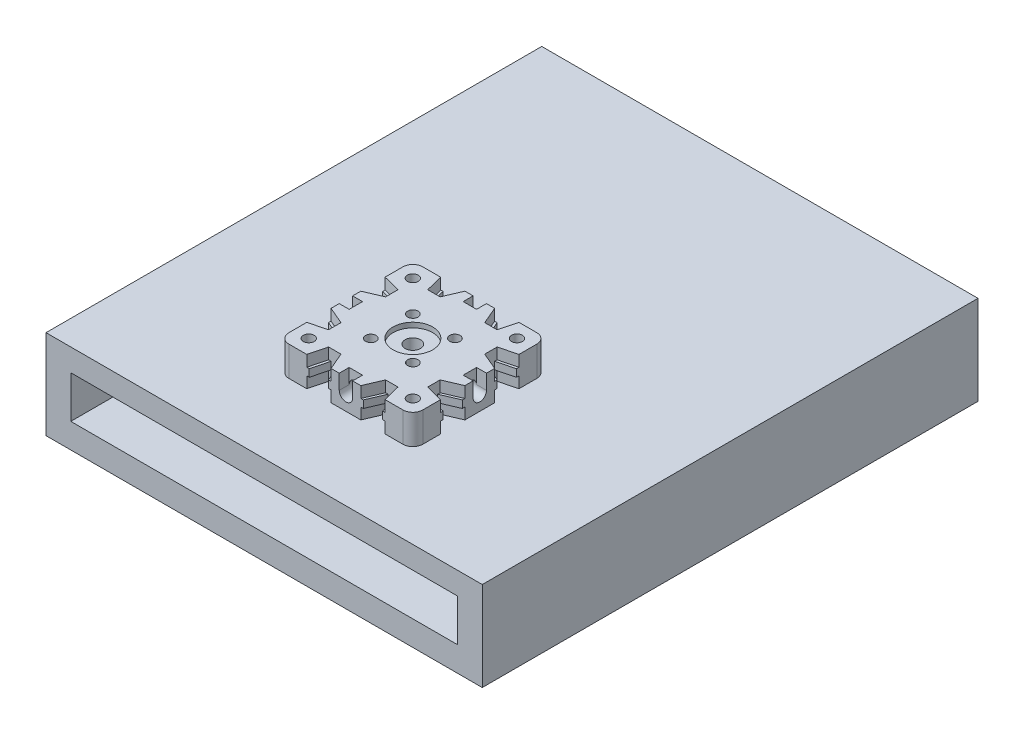
from build123d import *

# Parameters (mm, degrees)
SKETCH_3_W                      = 27
SKETCH_3_H                      = 27
EXTRUDE_1_DEPTH                 = 3
FILLET_1_R                      = 2
SKETCH_4_R                      = 1.1
CUT_EXTRUDE_1_DEPTH             = 6
SKETCH_5_R                      = 1.55
CUT_EXTRUDE_2_DEPTH             = 6
SKETCH_6_R                      = 1.05
CUT_EXTRUDE_3_DEPTH             = 6
PATTERN_CIRCULAR_1_COUNT        = 4
SKETCH_7_R                      = 4
CUT_EXTRUDE_4_DEPTH             = 1
CUT_EXTRUDE_8_DEPTH             = 21.012496096
PATTERN_CIRCULAR_2_COUNT        = 4
PATTERN_CIRCULAR_2_COPY_1_DEPTH = 21.012496096
PATTERN_CIRCULAR_2_COPY_2_DEPTH = 21.012496096
PATTERN_CIRCULAR_2_COPY_3_DEPTH = 21.012496096
SKETCH_12_R                     = 1.35
CUT_EXTRUDE_9_DEPTH             = 8
PATTERN_CIRCULAR_3_COUNT        = 4
EXTRUDE_2_DEPTH                 = 0.75
PATTERN_CIRCULAR_4_COUNT        = 4
PATTERN_CIRCULAR_4_COPY_1_DEPTH = 0.75
PATTERN_CIRCULAR_4_COPY_2_DEPTH = 0.75
PATTERN_CIRCULAR_4_COPY_3_DEPTH = 0.75
SKETCH_22_W                     = 2.7
SKETCH_22_H                     = 3
CUT_EXTRUDE_15_DEPTH            = 2
PATTERN_CIRCULAR_11_COUNT       = 4
SKETCH_31_W                     = 88
SKETCH_31_H                     = 100
EXTRUDE_4_DEPTH                 = 18
SKETCH_32_W                     = 78
SKETCH_32_H                     = 8.5
CUT_EXTRUDE_17_DEPTH            = 95


with BuildPart() as part:
    # ｽｹｯﾁ3 → ﾎﾞｽ - 押し出し1 (new, symmetric)
    with BuildSketch(Plane(origin=(0, 0, 0), x_dir=(1, 0, 0), z_dir=(0, 1, 0))):
        Rectangle(SKETCH_3_W, SKETCH_3_H)
    extrude(amount=EXTRUDE_1_DEPTH, both=True)

    # ﾌｨﾚｯﾄ1
    fillet_1_edges = [part.edges().sort_by_distance(p)[0] for p in [
        (13.5, 0, 13.5),
        (-13.5, 0, 13.5),
        (-13.5, 0, -13.5),
        (13.5, 0, -13.5),
    ]]
    fillet(fillet_1_edges, radius=FILLET_1_R)

    # ｽｹｯﾁ4 → ｶｯﾄ - 押し出し1 (cut)
    with BuildSketch(Plane(origin=(0, 3, 0), x_dir=(1, 0, 0), z_dir=(0, 1, 0))):
        with Locations(Location((-10.5, 10.5, 0), (0, 0, 270))):
            Circle(SKETCH_4_R)
        with Locations(Location((10.5, 10.5, 0), (0, 0, 270))):
            Circle(SKETCH_4_R)
        with Locations(Location((-10.5, -10.5, 0), (0, 0, 270))):
            Circle(SKETCH_4_R)
        with Locations(Location((10.5, -10.5, 0), (0, 0, 270))):
            Circle(SKETCH_4_R)
    extrude(amount=-CUT_EXTRUDE_1_DEPTH, mode=Mode.SUBTRACT)

    # ｽｹｯﾁ5 → ｶｯﾄ - 押し出し2 (cut)
    with BuildSketch(Plane(origin=(0, 3, 0), x_dir=(1, 0, 0), z_dir=(0, 1, 0))):
        with Locations(Location((0, 0, 0), (0, 0, 270))):
            Circle(SKETCH_5_R)
    extrude(amount=-CUT_EXTRUDE_2_DEPTH, mode=Mode.SUBTRACT)

    # ｽｹｯﾁ6 → ｶｯﾄ - 押し出し3 (cut)
    with BuildSketch(Plane(origin=(0, 3, 0), x_dir=(1, 0, 0), z_dir=(0, 1, 0))):
        with Locations(Location((4.242640687, 4.242640687, 0), (0, 0, 270))):
            Circle(SKETCH_6_R)
    cut_extrude_3 = extrude(amount=-CUT_EXTRUDE_3_DEPTH, mode=Mode.SUBTRACT)

    # 円形ﾊﾟﾀｰﾝ1: ｶｯﾄ - 押し出し3 ×4 about axis
    pattern_circular_1_axis = Axis((0, 0, 0), (0, 1, 0))
    for i in range(1, PATTERN_CIRCULAR_1_COUNT):
        add(cut_extrude_3.rotate(pattern_circular_1_axis, i * 360 / PATTERN_CIRCULAR_1_COUNT), mode=Mode.SUBTRACT)

    # ｽｹｯﾁ7 → ｶｯﾄ - 押し出し4 (cut)
    with BuildSketch(Plane(origin=(0, 3, 0), x_dir=(1, 0, 0), z_dir=(0, 1, 0))):
        with Locations(Location((0, 0, 0), (0, 0, 270))):
            Circle(SKETCH_7_R)
    extrude(amount=-CUT_EXTRUDE_4_DEPTH, mode=Mode.SUBTRACT)

    # ｽｹｯﾁ11 → ｶｯﾄ - 押し出し8 (cut, symmetric)
    with BuildSketch(Plane(origin=(0, 3, 0), x_dir=(1, 0, 0), z_dir=(0, 1, 0))):
        Polygon((-28.082033535, 86.024744916), (3, 13.5), (4.5, 10), (7, 10), (7.9, 13.5), (27.55047658, 89.918520033), (16.532211377, 247.342544779), (-39.100298738, 243.448769662), align=None)
    cut_extrude_8 = extrude(amount=CUT_EXTRUDE_8_DEPTH, both=True, mode=Mode.SUBTRACT)

    # ﾐﾗｰ1: ｶｯﾄ - 押し出し8 across plane
    add(cut_extrude_8.mirror(Plane(origin=(0, 0, 0), x_dir=(0, 0, 1), z_dir=(1, 0, 0))), mode=Mode.SUBTRACT)

    # 円形ﾊﾟﾀｰﾝ2: ｶｯﾄ - 押し出し8 ×4 about axis
    pattern_circular_2_axis = Axis((0, 0, 0), (0, 1, 0))
    for i in range(1, PATTERN_CIRCULAR_2_COUNT):
        add(cut_extrude_8.rotate(pattern_circular_2_axis, i * 360 / PATTERN_CIRCULAR_2_COUNT), mode=Mode.SUBTRACT)

    # 円形ﾊﾟﾀｰﾝ2 copy 1 sketch → 円形ﾊﾟﾀｰﾝ2 copy 1 (cut, symmetric)
    with BuildSketch(Plane.ZX.offset(3)):
        Polygon((-28.082033535, -86.024744916), (3, -13.5), (4.5, -10), (7, -10), (7.9, -13.5), (27.55047658, -89.918520033), (16.532211377, -247.342544779), (-39.100298738, -243.448769662), align=None)
    extrude(amount=PATTERN_CIRCULAR_2_COPY_1_DEPTH, both=True, mode=Mode.SUBTRACT)

    # 円形ﾊﾟﾀｰﾝ2 copy 2 sketch → 円形ﾊﾟﾀｰﾝ2 copy 2 (cut, symmetric)
    with BuildSketch(Plane(origin=(0, 3, 0), x_dir=(1, 0, 0), z_dir=(0, 1, 0))):
        Polygon((-28.082033535, -86.024744916), (3, -13.5), (4.5, -10), (7, -10), (7.9, -13.5), (27.55047658, -89.918520033), (16.532211377, -247.342544779), (-39.100298738, -243.448769662), align=None)
    extrude(amount=PATTERN_CIRCULAR_2_COPY_2_DEPTH, both=True, mode=Mode.SUBTRACT)

    # 円形ﾊﾟﾀｰﾝ2 copy 3 sketch → 円形ﾊﾟﾀｰﾝ2 copy 3 (cut, symmetric)
    with BuildSketch(Plane(origin=(0, 3, 0), x_dir=(0, 0, -1), z_dir=(0, 1, 0))):
        Polygon((-28.082033535, -86.024744916), (3, -13.5), (4.5, -10), (7, -10), (7.9, -13.5), (27.55047658, -89.918520033), (16.532211377, -247.342544779), (-39.100298738, -243.448769662), align=None)
    extrude(amount=PATTERN_CIRCULAR_2_COPY_3_DEPTH, both=True, mode=Mode.SUBTRACT)

    # ｽｹｯﾁ12 → ｶｯﾄ - 押し出し9 (cut)
    with BuildSketch(Plane.XY.offset(13.5)):
        Circle(SKETCH_12_R)
    cut_extrude_9 = extrude(amount=-CUT_EXTRUDE_9_DEPTH, mode=Mode.SUBTRACT)

    # 円形ﾊﾟﾀｰﾝ3: ｶｯﾄ - 押し出し9 ×4 about axis
    pattern_circular_3_axis = Axis((0, 0, 0), (0, 1, 0))
    for i in range(1, PATTERN_CIRCULAR_3_COUNT):
        add(cut_extrude_9.rotate(pattern_circular_3_axis, i * 360 / PATTERN_CIRCULAR_3_COUNT), mode=Mode.SUBTRACT)

    # ｽｹｯﾁ13 → ﾎﾞｽ - 押し出し2 (add, symmetric)
    with BuildSketch(Plane(origin=(0, 0, 0), x_dir=(1, 0, 0), z_dir=(0, 1, 0))):
        Polygon((7.9, 13.5), (7, 10), (6.5, 10), (7.4, 13.5), align=None)
        Polygon((3, 13.5), (3.5, 13.5), (5, 10), (4.5, 10), align=None)
    extrude_2 = extrude(amount=EXTRUDE_2_DEPTH, both=True)

    # ﾐﾗｰ2: ﾎﾞｽ - 押し出し2 across plane
    add(extrude_2.mirror(Plane(origin=(0, 0, 0), x_dir=(0, 0, 1), z_dir=(1, 0, 0))))

    # 円形ﾊﾟﾀｰﾝ4: ﾎﾞｽ - 押し出し2 ×4 about axis
    pattern_circular_4_axis = Axis((0, 0, 0), (0, 1, 0))
    for i in range(1, PATTERN_CIRCULAR_4_COUNT):
        add(extrude_2.rotate(pattern_circular_4_axis, i * 360 / PATTERN_CIRCULAR_4_COUNT))

    # 円形ﾊﾟﾀｰﾝ4 copy 1 sketch → 円形ﾊﾟﾀｰﾝ4 copy 1 (add, symmetric)
    with BuildSketch(Plane.ZX):
        Polygon((7.9, -13.5), (7, -10), (6.5, -10), (7.4, -13.5), align=None)
        Polygon((3, -13.5), (3.5, -13.5), (5, -10), (4.5, -10), align=None)
    extrude(amount=PATTERN_CIRCULAR_4_COPY_1_DEPTH, both=True)

    # 円形ﾊﾟﾀｰﾝ4 copy 2 sketch → 円形ﾊﾟﾀｰﾝ4 copy 2 (add, symmetric)
    with BuildSketch(Plane(origin=(0, 0, 0), x_dir=(1, 0, 0), z_dir=(0, 1, 0))):
        Polygon((7.9, -13.5), (7, -10), (6.5, -10), (7.4, -13.5), align=None)
        Polygon((3, -13.5), (3.5, -13.5), (5, -10), (4.5, -10), align=None)
    extrude(amount=PATTERN_CIRCULAR_4_COPY_2_DEPTH, both=True)

    # 円形ﾊﾟﾀｰﾝ4 copy 3 sketch → 円形ﾊﾟﾀｰﾝ4 copy 3 (add, symmetric)
    with BuildSketch(Plane(origin=(0, 0, 0), x_dir=(0, 0, -1), z_dir=(0, 1, 0))):
        Polygon((7.9, -13.5), (7, -10), (6.5, -10), (7.4, -13.5), align=None)
        Polygon((3, -13.5), (3.5, -13.5), (5, -10), (4.5, -10), align=None)
    extrude(amount=PATTERN_CIRCULAR_4_COPY_3_DEPTH, both=True)

    # ｽｹｯﾁ22 → ｶｯﾄ - 押し出し15 (cut)
    with BuildSketch(Plane.XY.offset(13.5)):
        with Locations((0, 1.5)):
            Rectangle(SKETCH_22_W, SKETCH_22_H)
    cut_extrude_15 = extrude(amount=-CUT_EXTRUDE_15_DEPTH, mode=Mode.SUBTRACT)

    # 円形ﾊﾟﾀｰﾝ11: ｶｯﾄ - 押し出し15 ×4 about axis
    pattern_circular_11_axis = Axis((0, 0, 0), (0, 1, 0))
    for i in range(1, PATTERN_CIRCULAR_11_COUNT):
        add(cut_extrude_15.rotate(pattern_circular_11_axis, i * 360 / PATTERN_CIRCULAR_11_COUNT), mode=Mode.SUBTRACT)

    # ｽｹｯﾁ31 → ﾎﾞｽ - 押し出し4 (add)
    with BuildSketch(Plane.XZ.offset(3)):
        with Locations((0, -20)):
            Rectangle(SKETCH_31_W, SKETCH_31_H)
    extrude(amount=EXTRUDE_4_DEPTH)

    # ｽｹｯﾁ32 → ｶｯﾄ - 押し出し17 (cut)
    with BuildSketch(Plane.XY.offset(30)):
        with Locations((0, -11.75)):
            Rectangle(SKETCH_32_W, SKETCH_32_H)
    extrude(amount=-CUT_EXTRUDE_17_DEPTH, mode=Mode.SUBTRACT)


solid = part.part
